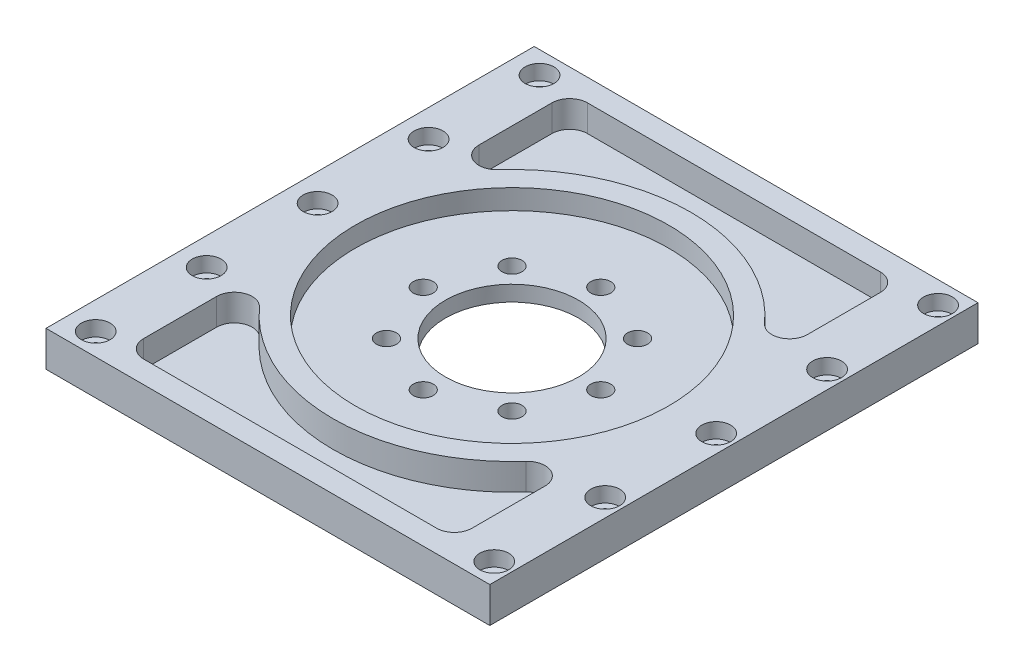
from build123d import *

# Parameters (mm, degrees)
SKETCH1_W                                           = 100
SKETCH1_H                                           = 110
BOSS_EXTRUDE1_DEPTH                                 = 8
CBORE_FOR_M3_HEX_SOCKET_HEAD_CAP_SCREW1_D           = 3.4
CBORE_FOR_M3_HEX_SOCKET_HEAD_CAP_SCREW1_DEPTH       = 8
CBORE_FOR_M3_HEX_SOCKET_HEAD_CAP_SCREW1_CBORE_D     = 6.5
CBORE_FOR_M3_HEX_SOCKET_HEAD_CAP_SCREW1_CBORE_DEPTH = 3.4
CBORE_FOR_M3_HEX_SOCKET_HEAD_CAP_SCREW1_TIP         = 1.021463052
F_30_0_30_DIAMETER_HOLE1_D                          = 30
F_30_0_30_DIAMETER_HOLE1_DEPTH                      = 10
F_30_0_30_DIAMETER_HOLE1_TIP                        = 9.012909285
SKETCH7_R                                           = 35.3
CUT_EXTRUDE1_DEPTH                                  = 4.5
M4_CLEARANCE_HOLE1_D                                = 4.5
CUT_EXTRUDE2_DEPTH                                  = 6
FILLET1_R                                           = 4


with BuildPart() as part:
    # Sketch1 → Boss-Extrude1 (new body)
    with BuildSketch(Plane(origin=(0, 0, 0), x_dir=(1, 0, 0), z_dir=(0, 1, 0))):
        with Locations((50, 55)):
            Rectangle(SKETCH1_W, SKETCH1_H)
    extrude(amount=BOSS_EXTRUDE1_DEPTH)

    # CBORE for M3 Hex Socket Head Cap Screw1
    with Locations(Plane(origin=(0, 8, 0), x_dir=(1, 0, 0), z_dir=(0, 1, 0))):
        with Locations((96, 105), (6.2, 105), (6.2, 80), (6.2, 55), (6.2, 30), (6.2, 5), (96, 55), (96, 30), (96, 5), (96, 80)):
            CounterBoreHole(CBORE_FOR_M3_HEX_SOCKET_HEAD_CAP_SCREW1_D / 2, CBORE_FOR_M3_HEX_SOCKET_HEAD_CAP_SCREW1_CBORE_D / 2, CBORE_FOR_M3_HEX_SOCKET_HEAD_CAP_SCREW1_CBORE_DEPTH, depth=CBORE_FOR_M3_HEX_SOCKET_HEAD_CAP_SCREW1_DEPTH)
            with Locations((0, 0, -(CBORE_FOR_M3_HEX_SOCKET_HEAD_CAP_SCREW1_DEPTH + CBORE_FOR_M3_HEX_SOCKET_HEAD_CAP_SCREW1_TIP / 2))):  # 118° drill point
                Cone(0, CBORE_FOR_M3_HEX_SOCKET_HEAD_CAP_SCREW1_D / 2, CBORE_FOR_M3_HEX_SOCKET_HEAD_CAP_SCREW1_TIP, mode=Mode.SUBTRACT)

    # Ø30.0 (30) Diameter Hole1
    with Locations(Plane(origin=(0, 8, 0), x_dir=(1, 0, 0), z_dir=(0, 1, 0))):
        with Locations((50, 55)):
            Hole(F_30_0_30_DIAMETER_HOLE1_D / 2, depth=F_30_0_30_DIAMETER_HOLE1_DEPTH)
            with Locations((0, 0, -(F_30_0_30_DIAMETER_HOLE1_DEPTH + F_30_0_30_DIAMETER_HOLE1_TIP / 2))):  # 118° drill point
                Cone(0, F_30_0_30_DIAMETER_HOLE1_D / 2, F_30_0_30_DIAMETER_HOLE1_TIP, mode=Mode.SUBTRACT)

    # Sketch7 → Cut-Extrude1 (cut)
    with BuildSketch(Plane(origin=(0, 8, 0), x_dir=(1, 0, 0), z_dir=(0, 1, 0))):
        with Locations(Location((50, 55, 0), (0, 0, 270))):
            Circle(SKETCH7_R)
    extrude(amount=-CUT_EXTRUDE1_DEPTH, mode=Mode.SUBTRACT)

    # M4 Clearance Hole1 (through all)
    with Locations(Plane(origin=(0, 0, 0), x_dir=(-1, 0, 0), z_dir=(0, -1, 0))):
        with Locations((-64.142135624, 69.142135624), (-50, 75), (-35.857864376, 69.142135624), (-30, 55), (-35.857864376, 40.857864376), (-50, 35), (-64.142135624, 40.857864376), (-70, 55)):
            Hole(M4_CLEARANCE_HOLE1_D / 2)

    # Sketch12 → Cut-Extrude2 (cut)
    with BuildSketch(Plane(origin=(0, 8, 0), x_dir=(1, 0, 0), z_dir=(0, 1, 0))):
        with BuildLine():
            Line((87, 105), (13, 105))
            Line((13, 105), (13, 70.971537183))
            ThreePointArc((13, 70.971537183), (50, 95.3), (87, 70.971537183))
            Line((87, 70.971537183), (87, 105))
        make_face()
        with BuildLine():
            ThreePointArc((87, 39.028462817), (50, 14.7), (13, 39.028462817))
            Line((13, 39.028462817), (13, 5))
            Line((13, 5), (87, 5))
            Line((87, 5), (87, 39.028462817))
        make_face()
    extrude(amount=-CUT_EXTRUDE2_DEPTH, mode=Mode.SUBTRACT)

    # Fillet1
    fillet1_edges = [part.edges().sort_by_distance(p)[0] for p in [
        (87, 5, -70.971537183),
        (13, 5, -70.971537183),
        (13, 5, -105),
        (87, 5, -105),
        (13, 5, -39.028462817),
        (87, 5, -39.028462817),
        (87, 5, -5),
        (13, 5, -5),
    ]]
    fillet(fillet1_edges, radius=FILLET1_R)


solid = part.part
